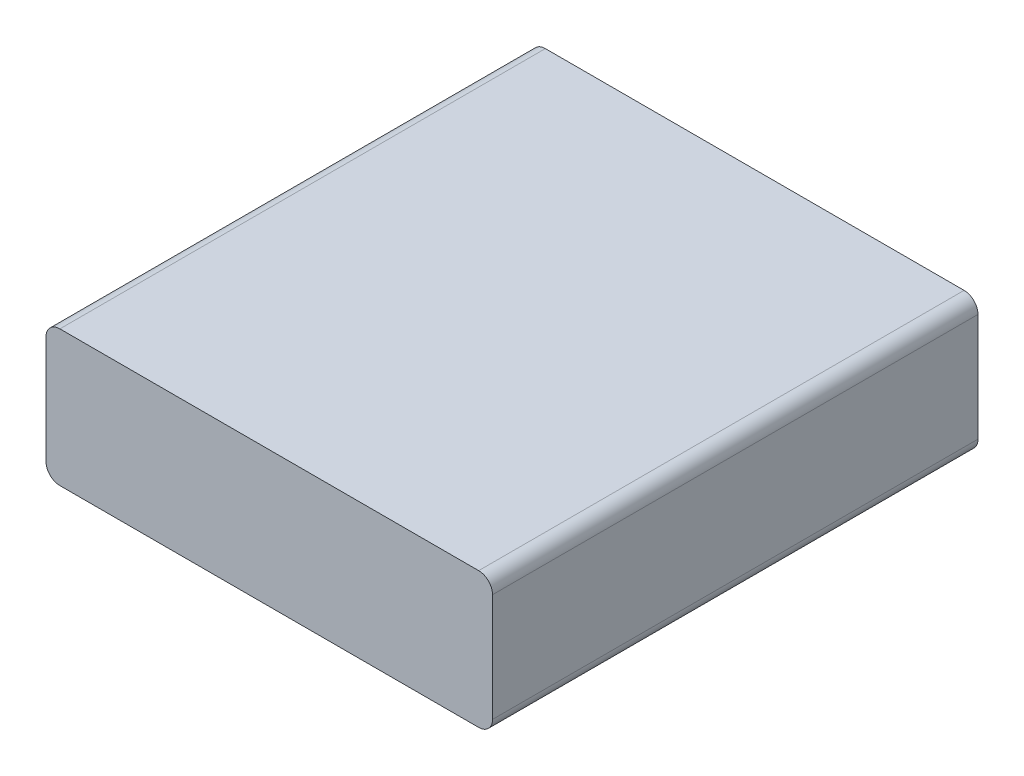
from build123d import *

# Parameters (mm, degrees)
SKETCH1_W  = 64.3
SKETCH1_H  = 19.55
BODY_DEPTH = 69.9
FILLET1_R  = 2


with BuildPart() as part:
    # Sketch1 → Body (new body)
    with BuildSketch(Plane.XY):
        Rectangle(SKETCH1_W, SKETCH1_H)
    extrude(amount=BODY_DEPTH)

    # Fillet1
    fillet1_edges = [part.edges().sort_by_distance(p)[0] for p in [
        (32.15, -9.775, 34.95),
        (-32.15, -9.775, 34.95),
        (-32.15, 9.775, 34.95),
        (32.15, 9.775, 34.95),
    ]]
    fillet(fillet1_edges, radius=FILLET1_R)


solid = part.part
